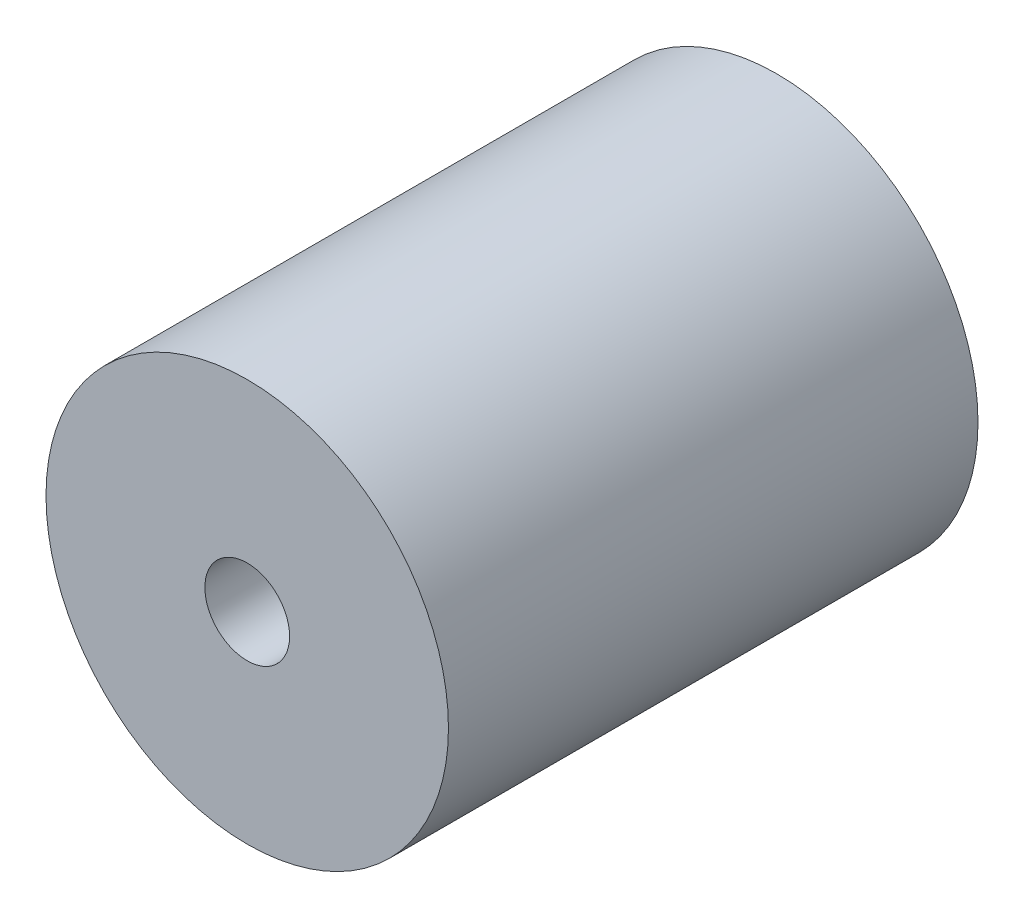
from build123d import *

# Parameters (mm, degrees)
SKETCH1_R           = 9.5
SKETCH1_R_2         = 2
BOSS_EXTRUDE1_DEPTH = 25


with BuildPart() as part:
    # Sketch1 → Boss-Extrude1 (new body)
    with BuildSketch(Plane.XY):
        Circle(SKETCH1_R)
        Circle(SKETCH1_R_2, mode=Mode.SUBTRACT)
    extrude(amount=BOSS_EXTRUDE1_DEPTH)


solid = part.part
